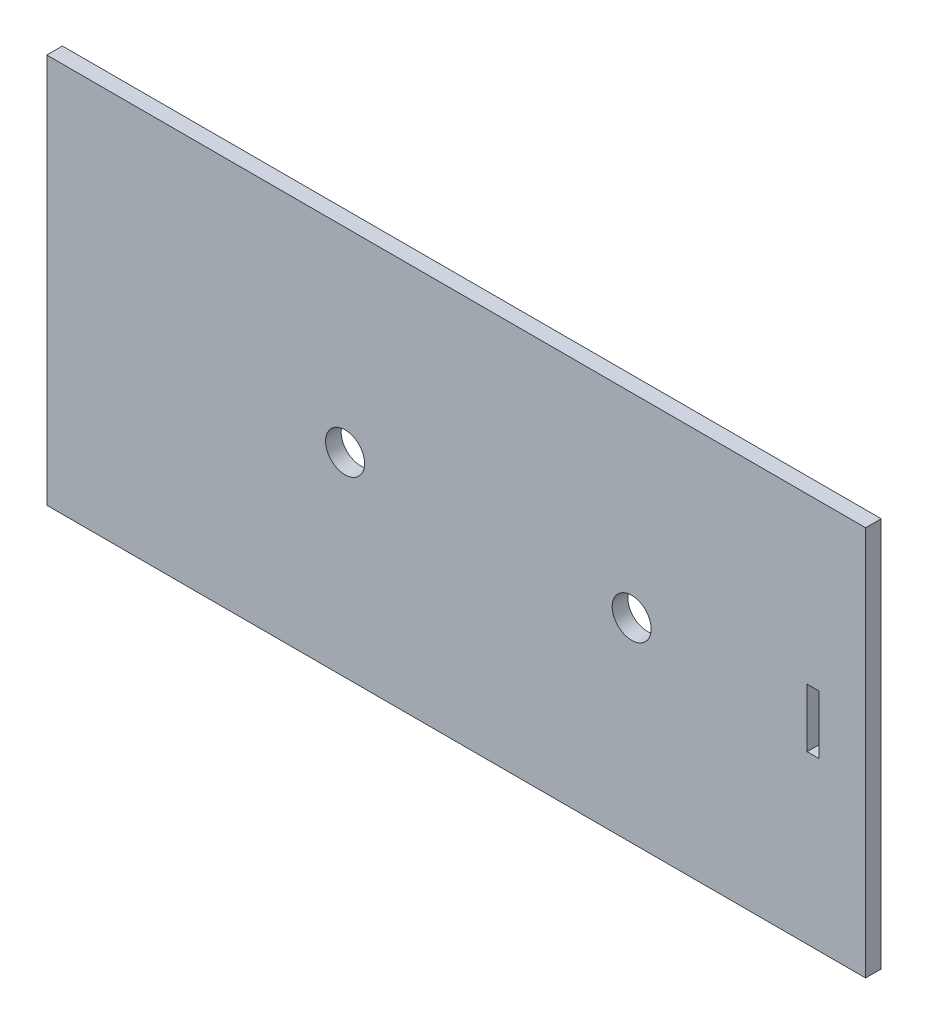
from build123d import *

# Parameters (mm, degrees)
SKETCH1_W           = 210
SKETCH1_H           = 100
SKETCH1_R           = 5
SKETCH1_W_2         = 3
SKETCH1_H_2         = 15
BOSS_EXTRUDE1_DEPTH = 4


with BuildPart() as part:
    # Sketch1 → Boss-Extrude1 (new body)
    with BuildSketch(Plane.XY):
        with Locations((-45, 0)):
            Rectangle(SKETCH1_W, SKETCH1_H)
        Circle(SKETCH1_R, mode=Mode.SUBTRACT)
        with Locations((-73.5, 0)):
            Circle(SKETCH1_R, mode=Mode.SUBTRACT)
        with Locations((46.5, 0.26206532)):
            Rectangle(SKETCH1_W_2, SKETCH1_H_2, mode=Mode.SUBTRACT)
    extrude(amount=BOSS_EXTRUDE1_DEPTH)


solid = part.part
